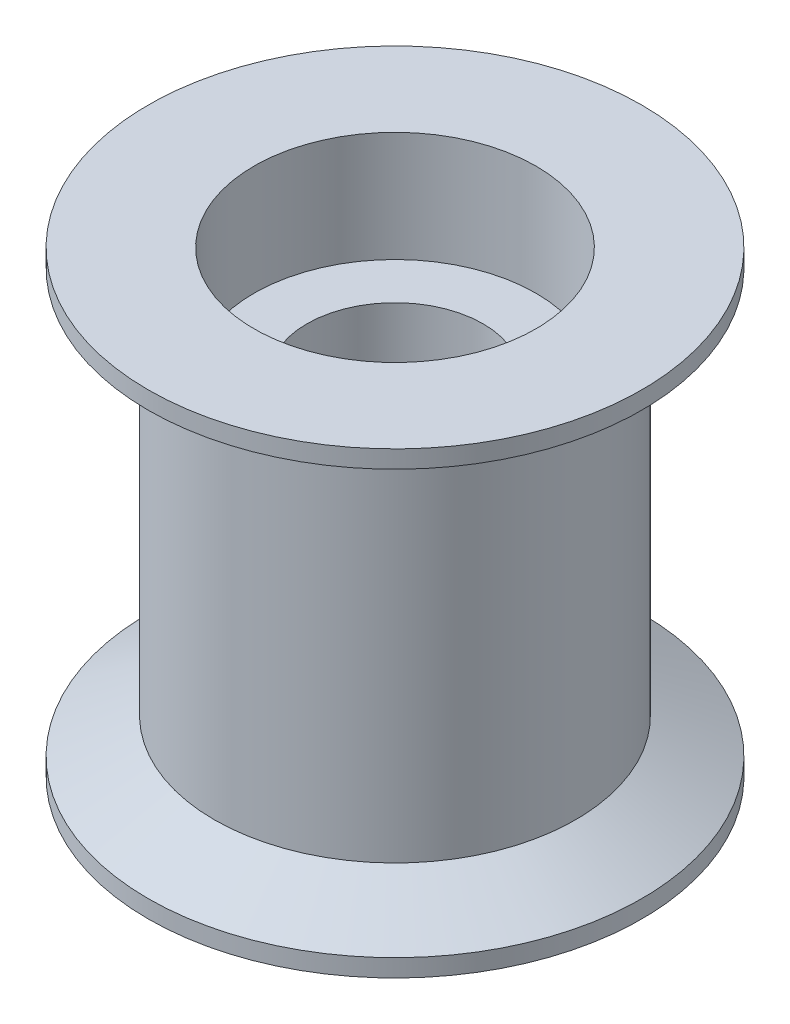
from build123d import *


with BuildPart() as part:
    # Sketch2 → Revolve1 (revolve)
    with BuildSketch(Plane(origin=(0, 0, 0), x_dir=(0, 0, -1), z_dir=(1, 0, 0))):
        Polygon((2.5, 0), (2.5, 3.375), (4, 3.375), (4, 6.5), (7, 6.5), (7, 6), (5.125, 5), (5.125, 0), align=None)
    revolve1 = revolve(axis=Axis((0, 0, 0), (0, 1, 0)))

    # Mirror1: Revolve1 across plane
    add(revolve1.mirror(Plane.ZX))


solid = part.part
